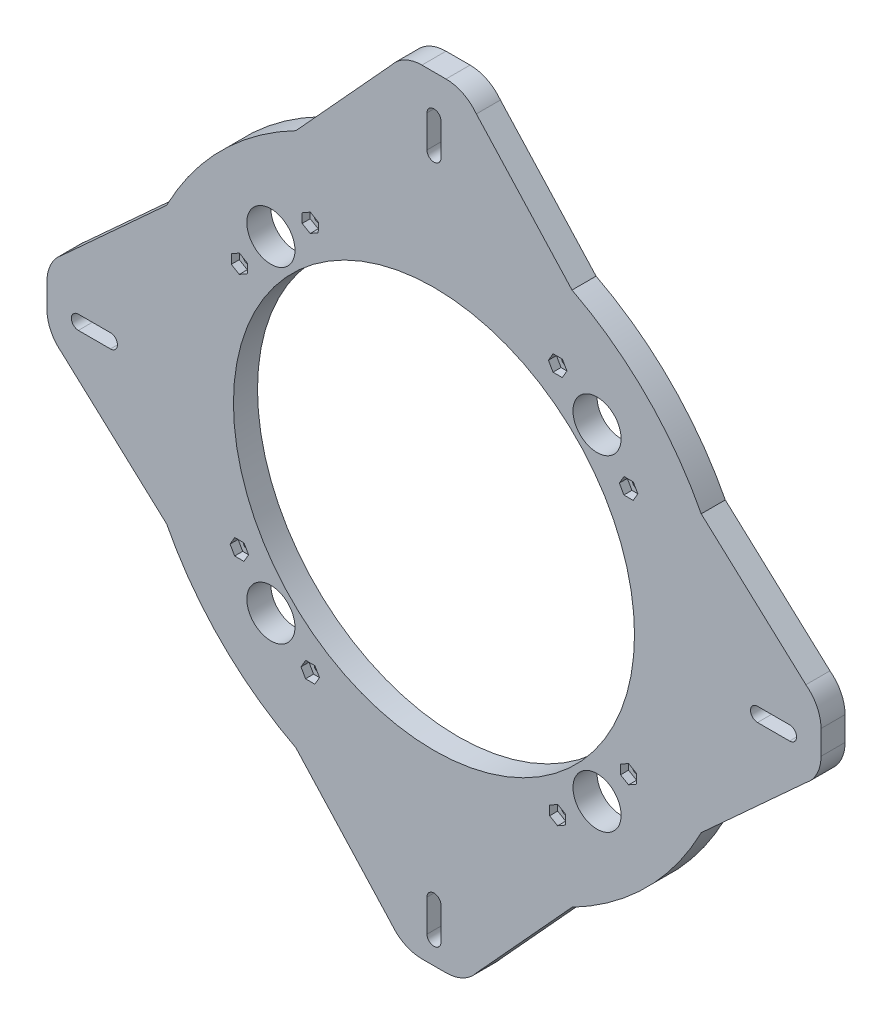
from build123d import *

# Parameters (mm, degrees)
ESQUISSE1_R             = 150
ESQUISSE1_R_2           = 100
BOSS_EXTRU_1_DEPTH      = 12
ESQUISSE2_R             = 17.5
BOSS_EXTRU_2_DEPTH      = 12
ESQUISSE3_R             = 10.5
BOSS_EXTRU_3_DEPTH      = 9
BOSS_EXTRU_4_DEPTH      = 12
BOSS_EXTRU_5_DEPTH      = 12
ENL_V_MAT_EXTRU_1_DEPTH = 274.749885845
ESQUISSE7_W             = 331.776450303
ESQUISSE7_H             = 53.126777449
ENL_V_MAT_EXTRU_2_DEPTH = 286
ESQUISSE8_R             = 12
ENL_V_MAT_EXTRU_3_DEPTH = 286
ENL_V_START             = 12
ENL_V_MAT_EXTRU_5_DEPTH = 4
ESQUISSE11_R            = 2
ENL_V_MAT_EXTRU_6_DEPTH = 10


with BuildPart() as part:
    # Esquisse1 → Boss.-Extru.1 (new body)
    with BuildSketch(Plane.XY):
        Circle(ESQUISSE1_R)
        Circle(ESQUISSE1_R_2, mode=Mode.SUBTRACT)
    extrude(amount=BOSS_EXTRU_1_DEPTH)

    # Esquisse2 → Boss.-Extru.2 (add)
    with BuildSketch(Plane.XY.offset(12)):
        with Locations((0, 125)):
            Circle(ESQUISSE2_R)
        with Locations((73.473156537, 101.127124297)):
            Circle(ESQUISSE2_R)
        with Locations((118.882064537, 38.627124297)):
            Circle(ESQUISSE2_R)
        with Locations((118.882064537, -38.627124297)):
            Circle(ESQUISSE2_R)
        with Locations((73.473156537, -101.127124297)):
            Circle(ESQUISSE2_R)
        with Locations((0, -125)):
            Circle(ESQUISSE2_R)
        with Locations((-73.473156537, -101.127124297)):
            Circle(ESQUISSE2_R)
        with Locations((-118.882064537, -38.627124297)):
            Circle(ESQUISSE2_R)
        with Locations((-118.882064537, 38.627124297)):
            Circle(ESQUISSE2_R)
        with Locations((-73.473156537, 101.127124297)):
            Circle(ESQUISSE2_R)
    extrude(amount=BOSS_EXTRU_2_DEPTH)

    # Esquisse3 → Boss.-Extru.3 (add)
    with BuildSketch(Plane.XY.offset(24)):
        with Locations((0, 125)):
            Circle(ESQUISSE3_R)
        with Locations((73.473156537, 101.127124297)):
            Circle(ESQUISSE3_R)
        with Locations((118.882064537, 38.627124297)):
            Circle(ESQUISSE3_R)
        with Locations((118.882064537, -38.627124297)):
            Circle(ESQUISSE3_R)
        with Locations((73.473156537, -101.127124297)):
            Circle(ESQUISSE3_R)
        with Locations((0, -125)):
            Circle(ESQUISSE3_R)
        with Locations((-73.473156537, -101.127124297)):
            Circle(ESQUISSE3_R)
        with Locations((-118.882064537, -38.627124297)):
            Circle(ESQUISSE3_R)
        with Locations((-118.882064537, 38.627124297)):
            Circle(ESQUISSE3_R)
        with Locations((-73.473156537, 101.127124297)):
            Circle(ESQUISSE3_R)
    extrude(amount=BOSS_EXTRU_3_DEPTH)

    # Esquisse4 → Boss.-Extru.4 (add)
    # profile 1 of 4: a face of its own
    with BuildSketch(Plane.XY.offset(12)):
        with BuildLine():
            Line((-14, 145), (-14, 185))
            ThreePointArc((-14, 185), (-11.656854249, 190.656854249), (-6, 193))
            Line((-6, 193), (6, 193))
            ThreePointArc((6, 193), (11.656854249, 190.656854249), (14, 185))
            Line((14, 185), (14, 145))
            Line((14, 145), (-14, 145))
        make_face()
        with BuildLine():
            Line((-3.75, 154.53605372), (-3.75, 184.53605372))
            ThreePointArc((-3.75, 184.53605372), (0, 188.28605372), (3.75, 184.53605372))
            Line((3.75, 184.53605372), (3.75, 154.53605372))
            ThreePointArc((3.75, 154.53605372), (0, 150.78605372), (-3.75, 154.53605372))
        make_face(mode=Mode.SUBTRACT)
    # profile 2 of 4: a face of its own
    with BuildSketch(Plane.XY.offset(12)):
        with BuildLine():
            Line((145, 14), (145, -14))
            Line((145, -14), (185, -14))
            ThreePointArc((185, -14), (190.656854249, -11.656854249), (193, -6))
            Line((193, -6), (193, 6))
            ThreePointArc((193, 6), (190.656854249, 11.65685425), (185, 14))
            Line((185, 14), (145, 14))
        make_face()
        with BuildLine():
            Line((154.53605372, -3.75), (184.53605372, -3.75))
            ThreePointArc((184.53605372, -3.75), (188.28605372, 0), (184.53605372, 3.75))
            Line((184.53605372, 3.75), (154.53605372, 3.75))
            ThreePointArc((154.53605372, 3.75), (150.78605372, 0), (154.53605372, -3.75))
        make_face(mode=Mode.SUBTRACT)
    # profile 3 of 4: a face of its own
    with BuildSketch(Plane.XY.offset(12)):
        with BuildLine():
            Line((14, -145), (-14, -145))
            Line((-14, -145), (-14, -185))
            ThreePointArc((-14, -185), (-11.656854249, -190.656854249), (-6, -193))
            Line((-6, -193), (6, -193))
            ThreePointArc((6, -193), (11.656854249, -190.656854249), (14, -185))
            Line((14, -185), (14, -145))
        make_face()
        with BuildLine():
            Line((-3.75, -154.53605372), (-3.75, -184.53605372))
            ThreePointArc((-3.75, -184.53605372), (0, -188.28605372), (3.75, -184.53605372))
            Line((3.75, -184.53605372), (3.75, -154.53605372))
            ThreePointArc((3.75, -154.53605372), (0, -150.78605372), (-3.75, -154.53605372))
        make_face(mode=Mode.SUBTRACT)
    # profile 4 of 4: a face of its own
    with BuildSketch(Plane.XY.offset(12)):
        with BuildLine():
            Line((-145, -14), (-145, 14))
            Line((-145, 14), (-185, 14))
            ThreePointArc((-185, 14), (-190.656854249, 11.65685425), (-193, 6))
            Line((-193, 6), (-193, -6))
            ThreePointArc((-193, -6), (-190.656854249, -11.656854249), (-185, -14))
            Line((-185, -14), (-145, -14))
        make_face()
        with BuildLine():
            Line((-154.53605372, 3.75), (-184.53605372, 3.75))
            ThreePointArc((-184.53605372, 3.75), (-188.28605372, 0), (-184.53605372, -3.75))
            Line((-184.53605372, -3.75), (-154.53605372, -3.75))
            ThreePointArc((-154.53605372, -3.75), (-150.78605372, 0), (-154.53605372, 3.75))
        make_face(mode=Mode.SUBTRACT)
    extrude(amount=-BOSS_EXTRU_4_DEPTH)

    # Esquisse5 → Boss.-Extru.5 (add)
    with BuildSketch(Plane.XY.offset(12)):
        with BuildLine():
            Line((-6, 193), (6, 193))
            ThreePointArc((6, 193), (14.453112805, 191.014875198), (21.138947402, 185.474527528))
            Line((21.138947402, 185.474527528), (78.676319934, 122.506579561))
            Line((78.676319934, 122.506579561), (0, 146.402607913))
            Line((0, 146.402607913), (-78.676319934, 122.506579561))
            Line((-78.676319934, 122.506579561), (-21.138947402, 185.474527528))
            ThreePointArc((-21.138947402, 185.474527528), (-14.453112805, 191.014875198), (-6, 193))
        make_face()
        with BuildLine():
            Line((146.402607913, 0), (122.506579561, -78.676319934))
            Line((122.506579561, -78.676319934), (185.474527528, -21.138947402))
            ThreePointArc((185.474527528, -21.138947402), (191.014875198, -14.453112805), (193, -6))
            Line((193, -6), (193, 6))
            ThreePointArc((193, 6), (191.014875198, 14.453112805), (185.474527528, 21.138947402))
            Line((185.474527528, 21.138947402), (122.506579561, 78.676319934))
            Line((122.506579561, 78.676319934), (146.402607913, 0))
        make_face()
        with BuildLine():
            Line((0, -146.402607913), (-78.676319934, -122.506579561))
            Line((-78.676319934, -122.506579561), (-21.138947402, -185.474527528))
            ThreePointArc((-21.138947402, -185.474527528), (-14.453112805, -191.014875198), (-6, -193))
            Line((-6, -193), (6, -193))
            ThreePointArc((6, -193), (14.453112805, -191.014875198), (21.138947402, -185.474527528))
            Line((21.138947402, -185.474527528), (78.676319934, -122.506579561))
            Line((78.676319934, -122.506579561), (0, -146.402607913))
        make_face()
        with BuildLine():
            Line((-146.402607913, 0), (-122.506579561, 78.676319934))
            Line((-122.506579561, 78.676319934), (-185.474527528, 21.138947402))
            ThreePointArc((-185.474527528, 21.138947402), (-191.014875198, 14.453112805), (-193, 6))
            Line((-193, 6), (-193, -6))
            ThreePointArc((-193, -6), (-191.014875198, -14.453112805), (-185.474527528, -21.138947402))
            Line((-185.474527528, -21.138947402), (-122.506579561, -78.676319934))
            Line((-122.506579561, -78.676319934), (-146.402607913, 0))
        make_face()
    extrude(amount=-BOSS_EXTRU_5_DEPTH)

    # Esquisse6 → Enlèv. mat.-Extru.1 (cut, through all)
    with BuildSketch(Plane.XY.offset(12)):
        with BuildLine():
            Line((-3.5, 157.595940505), (-3.5, 173.595940505))
            ThreePointArc((-3.5, 173.595940505), (0, 177.095940505), (3.5, 173.595940505))
            Line((3.5, 173.595940505), (3.5, 157.595940505))
            ThreePointArc((3.5, 157.595940505), (0, 154.095940505), (-3.5, 157.595940505))
        make_face()
        with BuildLine():
            Line((161.329273839, -7.233333333), (177.329273839, -7.233333333))
            ThreePointArc((177.329273839, -7.233333333), (180.829273839, -3.733333333), (177.329273839, -0.233333333))
            Line((177.329273839, -0.233333333), (161.329273839, -0.233333333))
            ThreePointArc((161.329273839, -0.233333333), (157.829273839, -3.733333333), (161.329273839, -7.233333333))
        make_face()
        with BuildLine():
            Line((-3.5, -165.062607172), (-3.5, -181.062607172))
            ThreePointArc((-3.5, -181.062607172), (0, -184.562607172), (3.5, -181.062607172))
            Line((3.5, -181.062607172), (3.5, -165.062607172))
            ThreePointArc((3.5, -165.062607172), (0, -161.562607172), (-3.5, -165.062607172))
        make_face()
        with BuildLine():
            Line((-161.329273838, -0.233333333), (-177.329273838, -0.233333333))
            ThreePointArc((-177.329273838, -0.233333333), (-180.829273838, -3.733333333), (-177.329273838, -7.233333333))
            Line((-177.329273838, -7.233333333), (-161.329273838, -7.233333333))
            ThreePointArc((-161.329273838, -7.233333333), (-157.829273838, -3.733333333), (-161.329273838, -0.233333333))
        make_face()
    extrude(amount=-ENL_V_MAT_EXTRU_1_DEPTH, mode=Mode.SUBTRACT)

    # Esquisse7 → Enlèv. mat.-Extru.2 (cut, symmetric)
    with BuildSketch(Plane(origin=(0, 0, 0), x_dir=(1, 0, 0), z_dir=(0, 1, 0))):
        with Locations((9.877314169, -38.563388725)):
            Rectangle(ESQUISSE7_W, ESQUISSE7_H)
    extrude(amount=ENL_V_MAT_EXTRU_2_DEPTH, both=True, mode=Mode.SUBTRACT)

    # Esquisse8 → Enlèv. mat.-Extru.3 (cut, symmetric)
    with BuildSketch(Plane.XY.offset(12)):
        with Locations((81.317279836, 81.317279836)):
            Circle(ESQUISSE8_R)
        with Locations((-81.317279836, 81.317279836)):
            Circle(ESQUISSE8_R)
        with Locations((81.317279836, -81.317279836)):
            Circle(ESQUISSE8_R)
        with Locations((-81.317279836, -81.317279836)):
            Circle(ESQUISSE8_R)
    extrude(amount=ENL_V_MAT_EXTRU_3_DEPTH, both=True, mode=Mode.SUBTRACT)

    # Esquisse10 → Enlèv. mat.-Extru.5 (cut)
    with BuildSketch(Plane.XY.offset(ENL_V_START)):
        Polygon((-65.707736407, 94.76323817), (-61.720728388, 92.431479094), (-57.707861783, 94.718449786), (-57.682003198, 99.337179554), (-61.669011217, 101.668938629), (-65.681877822, 99.381967937), align=None)
        Polygon((-101.668938629, -61.669011217), (-99.381967937, -65.681877822), (-94.76323817, -65.707736407), (-92.431479094, -61.720728388), (-94.718449786, -57.707861783), (-99.337179554, -57.682003198), align=None)
        Polygon((-57.076140035, -97.076067447), (-59.363110727, -93.063200842), (-63.981840494, -93.037342257), (-66.31359957, -97.024350276), (-64.026628878, -101.037216881), (-59.40789911, -101.063075466), align=None)
        Polygon((-101.037216881, 64.026628878), (-101.063075466, 59.40789911), (-97.076067447, 57.076140035), (-93.063200842, 59.363110727), (-93.037342257, 63.981840494), (-97.024350276, 66.31359957), align=None)
        Polygon((94.76323817, 65.707736407), (92.431479094, 61.720728388), (94.718449786, 57.707861783), (99.337179554, 57.682003198), (101.668938629, 61.669011217), (99.381967937, 65.681877822), align=None)
        Polygon((64.026628878, 101.037216881), (59.40789911, 101.063075466), (57.076140035, 97.076067447), (59.363110727, 93.063200842), (63.981840494, 93.037342257), (66.31359957, 97.024350276), align=None)
        Polygon((65.707736407, -94.76323817), (61.720728388, -92.431479094), (57.707861783, -94.718449786), (57.682003198, -99.337179554), (61.669011217, -101.668938629), (65.681877822, -99.381967937), align=None)
        Polygon((101.037216881, -64.026628878), (101.063075466, -59.40789911), (97.076067447, -57.076140035), (93.063200842, -59.363110727), (93.037342257, -63.981840494), (97.024350276, -66.31359957), align=None)
    extrude(amount=-ENL_V_MAT_EXTRU_5_DEPTH, mode=Mode.SUBTRACT)

    # Esquisse11 → Enlèv. mat.-Extru.6 (cut)
    with BuildSketch(Plane.XY):
        with Locations((-97.050208862, -61.694869802)):
            Circle(ESQUISSE11_R)
        with Locations((-61.694869802, -97.050208862)):
            Circle(ESQUISSE11_R)
        with Locations((-61.694869802, 97.050208862)):
            Circle(ESQUISSE11_R)
        with Locations((-97.050208862, 61.694869802)):
            Circle(ESQUISSE11_R)
        with Locations((97.050208862, 61.694869802)):
            Circle(ESQUISSE11_R)
        with Locations((61.694869802, 97.050208862)):
            Circle(ESQUISSE11_R)
        with Locations((61.694869802, -97.050208862)):
            Circle(ESQUISSE11_R)
        with Locations((97.050208862, -61.694869802)):
            Circle(ESQUISSE11_R)
    extrude(amount=ENL_V_MAT_EXTRU_6_DEPTH, mode=Mode.SUBTRACT)


solid = part.part
